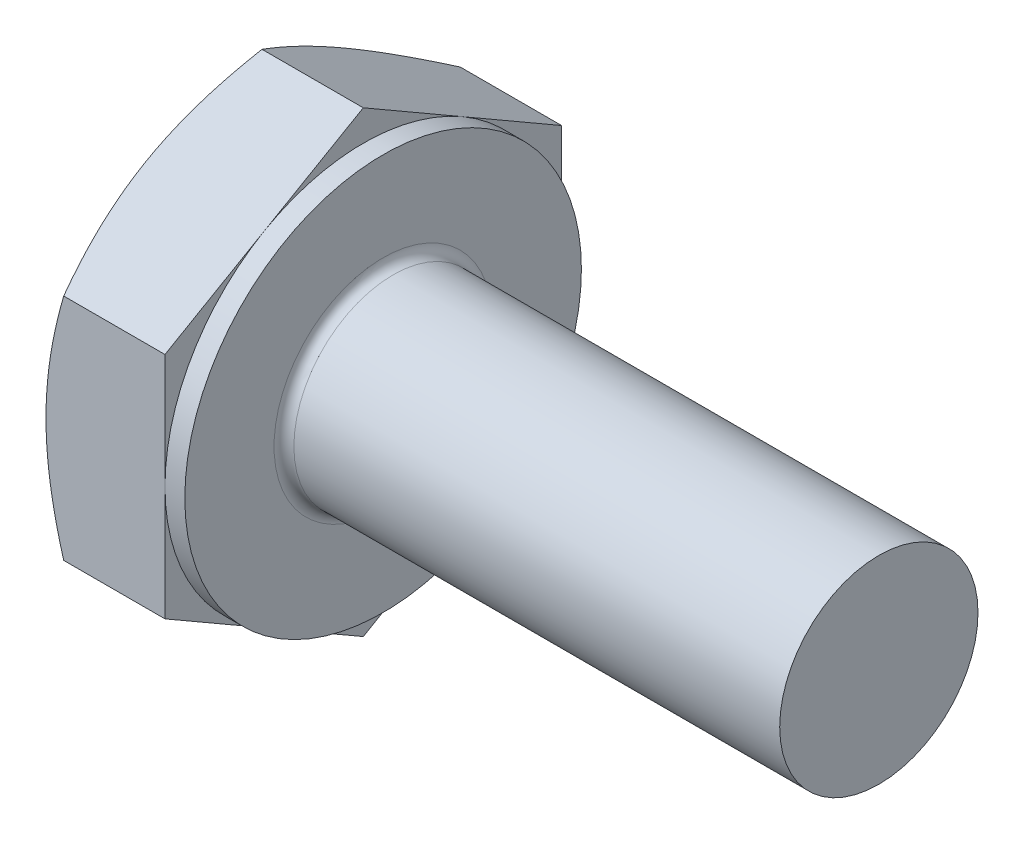
from build123d import *

# Parameters (mm, degrees)
EXTRUDE_364_DEPTH   = 1.4
SKETCH_4_W          = 0.2
SKETCH_4_H          = 10.309401077
CHAMFER_2035_SIZE   = 0.32
FILLET_2080_R       = 0.1
SKETCH_7_R          = 1.592949274
CUT_EXTRUDE_1_DEPTH = 15


with BuildPart() as part:
    # 草图1 → Extrude 364 (new body)
    with BuildSketch(Plane(origin=(0, 0, 0), x_dir=(0, 0, -1), z_dir=(1, 0, 0))):
        Polygon((2, 1.154700538), (2, -1.154700538), (0, -2.309401077), (-2, -1.154700538), (-2, 1.154700538), (0, 2.309401077), align=None)
    extrude(amount=EXTRUDE_364_DEPTH)

    # 草图2 → 凸台-旋转1 (revolve)
    with BuildSketch(Plane.XY, mode=Mode.PRIVATE) as revolve_1_sk:
        Polygon((0, 0), (21.4, 0), (21.4, 0.6536), (21.4, 1), (7.791693541, 1), (0, 1), align=None)
    revolve(revolve_1_sk.sketch.rotate(Axis((0, 0, 0), (1, 0, 0)), 90), axis=Axis((0, 0, 0), (1, 0, 0)))

    # 草图3 → 切除-旋转1 (revolve, cut)
    with BuildSketch(Plane.XY):
        Polygon((0, 2), (3.065384141, 7.309401077), (3.065384141, 12.309401077), (-10, 12.309401077), (-10, 2), align=None)
    revolve(axis=Axis((0, 0, 0), (1, 0, 0)), mode=Mode.SUBTRACT)

    # 草图5 → 切除-旋转2 (revolve, cut)
    with BuildSketch(Plane.XY):
        Polygon((1.4, 2), (-1.665384141, 7.309401077), (-1.665384141, 12.309401077), (8.334615859, 12.309401077), (8.334615859, 2), align=None)
    revolve(axis=Axis((0, 0, 0), (1, 0, 0)), mode=Mode.SUBTRACT)

    # 草图4 → 切除-旋转3 (revolve, cut)
    with BuildSketch(Plane.XY, mode=Mode.PRIVATE) as cut_revolve_3_sk:
        with Locations((1.3, 7.154700539)):
            Rectangle(SKETCH_4_W, SKETCH_4_H)
    revolve(cut_revolve_3_sk.sketch.rotate(Axis((0, 0, 0), (1, 0, 0)), 270), axis=Axis((0, 0, 0), (1, 0, 0)), mode=Mode.SUBTRACT)

    # Chamfer 2035
    chamfer_2035_edges = [part.edges().sort_by_distance(p)[0] for p in [
        (21.4, 0, -1),
    ]]
    chamfer(chamfer_2035_edges, length=CHAMFER_2035_SIZE)

    # Fillet 2080
    fillet_2080_edges = [part.edges().sort_by_distance(p)[0] for p in [
        (1.4, 0, -1),
    ]]
    fillet(fillet_2080_edges, radius=FILLET_2080_R)

    # 草图7 → 切除-拉伸1 (cut)
    with BuildSketch(Plane(origin=(21.4, 0, 0), x_dir=(0, 0, -1), z_dir=(1, 0, 0))):
        Circle(SKETCH_7_R)
    extrude(amount=-CUT_EXTRUDE_1_DEPTH, mode=Mode.SUBTRACT)


solid = part.part
